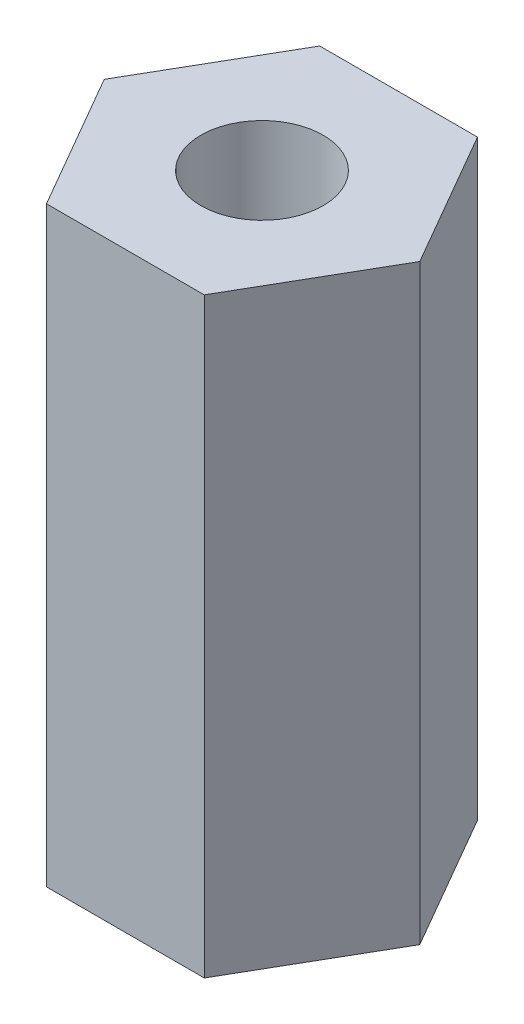
from build123d import *

# Parameters (mm, degrees)
SKETCH_1_R      = 1.55
EXTRUDE_1_DEPTH = 15


with BuildPart() as part:
    # 草圖1 → 填料-伸長1 (new body)
    with BuildSketch(Plane(origin=(0, 0, 0), x_dir=(1, 0, 0), z_dir=(0, 1, 0))):
        Polygon((2, 3.464101615), (-2, 3.464101615), (-4, 0), (-2, -3.464101615), (2, -3.464101615), (4, 0), align=None)
        with Locations(Location((0, 0, 0), (0, 0, 270))):
            Circle(SKETCH_1_R, mode=Mode.SUBTRACT)
    extrude(amount=EXTRUDE_1_DEPTH)


solid = part.part
